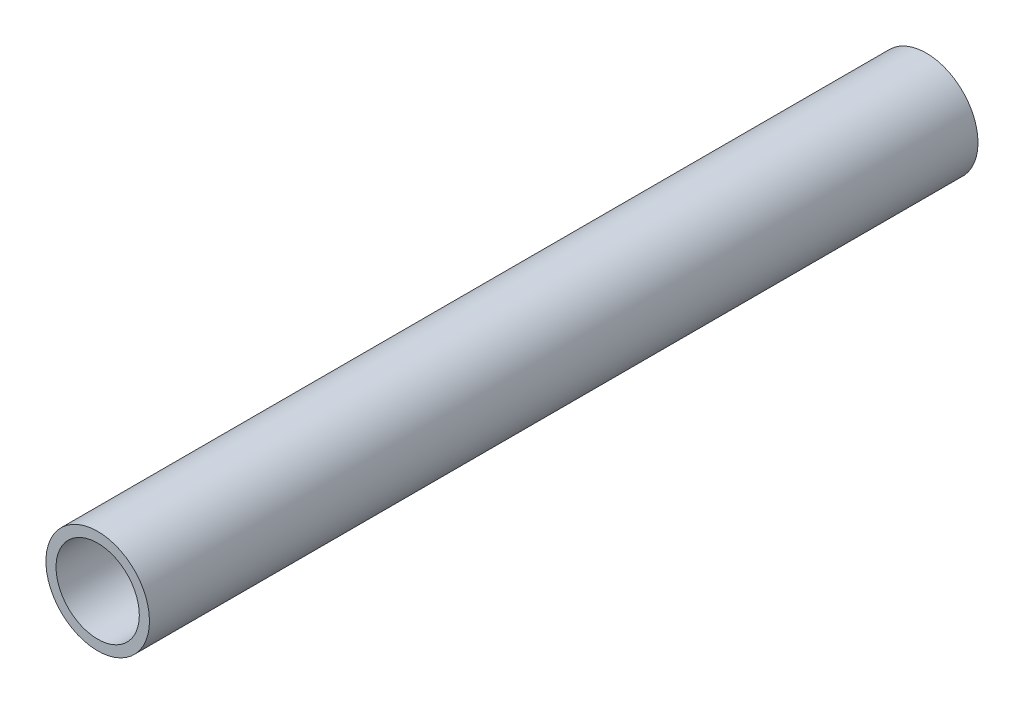
from build123d import *

# Parameters (mm, degrees)
SKETCH1_R           = 3.175
SKETCH1_R_2         = 2.5527
BOSS_EXTRUDE1_DEPTH = 25.4


with BuildPart() as part:
    # Sketch1 → Boss-Extrude1 (new, symmetric)
    with BuildSketch(Plane.XY):
        Circle(SKETCH1_R)
        Circle(SKETCH1_R_2, mode=Mode.SUBTRACT)
    extrude(amount=BOSS_EXTRUDE1_DEPTH, both=True)


solid = part.part
